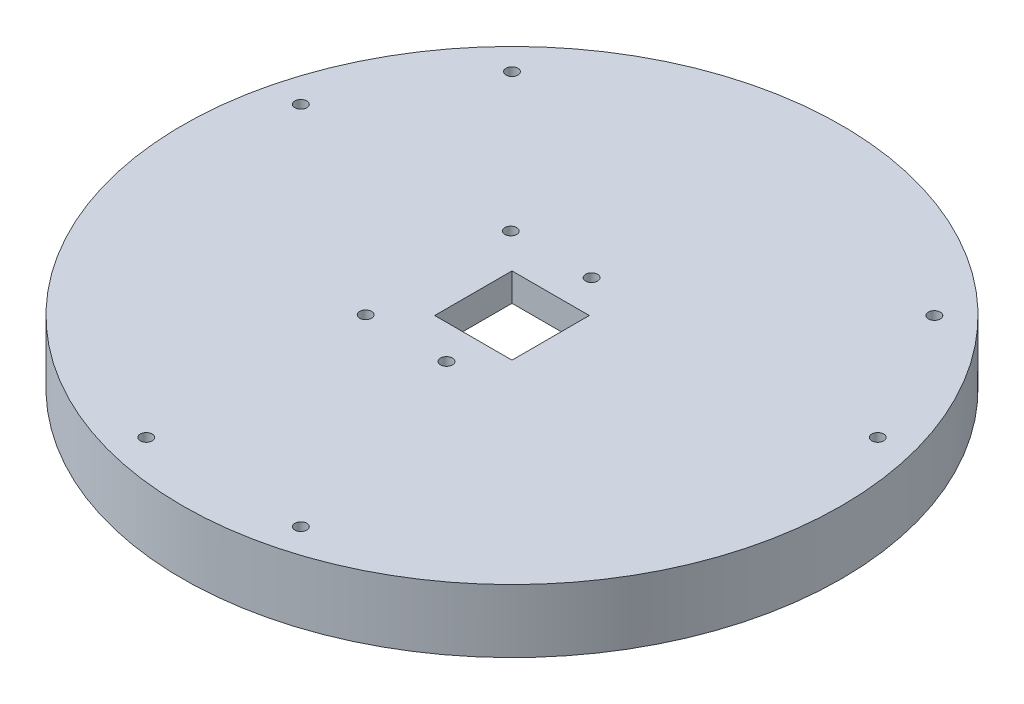
from build123d import *

# Parameters (mm, degrees)
SKETCH_1_R          = 46.9
SKETCH_1_R_2        = 45.1
EXTRUDE_2_DEPTH     = 5
SKETCH_2_R          = 46.9
EXTRUDE_1_DEPTH     = 4
SKETCH_4_W          = 11
SKETCH_4_H          = 11
CUT_EXTRUDE_1_DEPTH = 67.514810381
HOLE_WIZARD_2_D     = 1.7
HOLE_WIZARD_2_DEPTH = 4.4
CHAMFER_1_SIZE      = 0.3
HOLE_WIZARD_1_D     = 1.7
EXTRUDE_2_2_DEPTH   = 4


with BuildPart() as part:
    # 草图1 → Extrude 2 (new body)
    with BuildSketch(Plane(origin=(0, 0, 0), x_dir=(1, 0, 0), z_dir=(0, 1, 0))):
        Circle(SKETCH_1_R)
        Circle(SKETCH_1_R_2, mode=Mode.SUBTRACT)
    extrude(amount=EXTRUDE_2_DEPTH)

    # 草图2 → 凸台-拉伸1 (add)
    with BuildSketch(Plane(origin=(0, 5, 0), x_dir=(1, 0, 0), z_dir=(0, 1, 0))):
        Circle(SKETCH_2_R)
    extrude(amount=EXTRUDE_1_DEPTH)

    # 草图4 → 切除-拉伸1 (cut, through all)
    with BuildSketch(Plane.XZ.offset(-5)):
        Rectangle(SKETCH_4_W, SKETCH_4_H)
    extrude(amount=-CUT_EXTRUDE_1_DEPTH, mode=Mode.SUBTRACT)

    # 孔2
    with Locations(Plane(origin=(0, 5, 0), x_dir=(-1, 0, 0), z_dir=(0, -1, 0))):
        with Locations((-1, 10.326086957), (10.5, 10.326086957), (10.5, -10.326086957), (-1, -10.326086957)):
            Hole(HOLE_WIZARD_2_D / 2, depth=HOLE_WIZARD_2_DEPTH)

    # 倒角1
    chamfer_1_edges = [part.edges().sort_by_distance(p)[0] for p in [
        (-45.1, 0, 0),
    ]]
    chamfer(chamfer_1_edges, length=CHAMFER_1_SIZE)

    # 孔1 (through all)
    with Locations(Plane(origin=(0, 9, 0), x_dir=(1, 0, 0), z_dir=(0, 1, 0))):
        with Locations((-41.051847617, 10.999809417), (-30.0520382, 30.0520382), (30.0520382, 30.0520382), (41.051847617, 10.999809417), (10.999809417, -41.051847617), (-10.999809417, -41.051847617)):
            Hole(HOLE_WIZARD_1_D / 2)

    # 草图20 → Extrude 2 2 (add)
    with BuildSketch(Plane.XZ.offset(-5)):
        with BuildLine():
            Line((17.668302266, 41.386363636), (17.668302266, 35.886363636))
            ThreePointArc((17.668302266, 35.886363636), (19.60780664, 34.86450801), (21.488415705, 33.737931034))
            Line((21.488415705, 33.737931034), (21.488415705, 39.537931034))
            ThreePointArc((21.488415705, 39.537931034), (19.60016113, 40.50720533), (17.668302266, 41.386363636))
        make_face()
    extrude(amount=EXTRUDE_2_2_DEPTH)


solid = part.part
